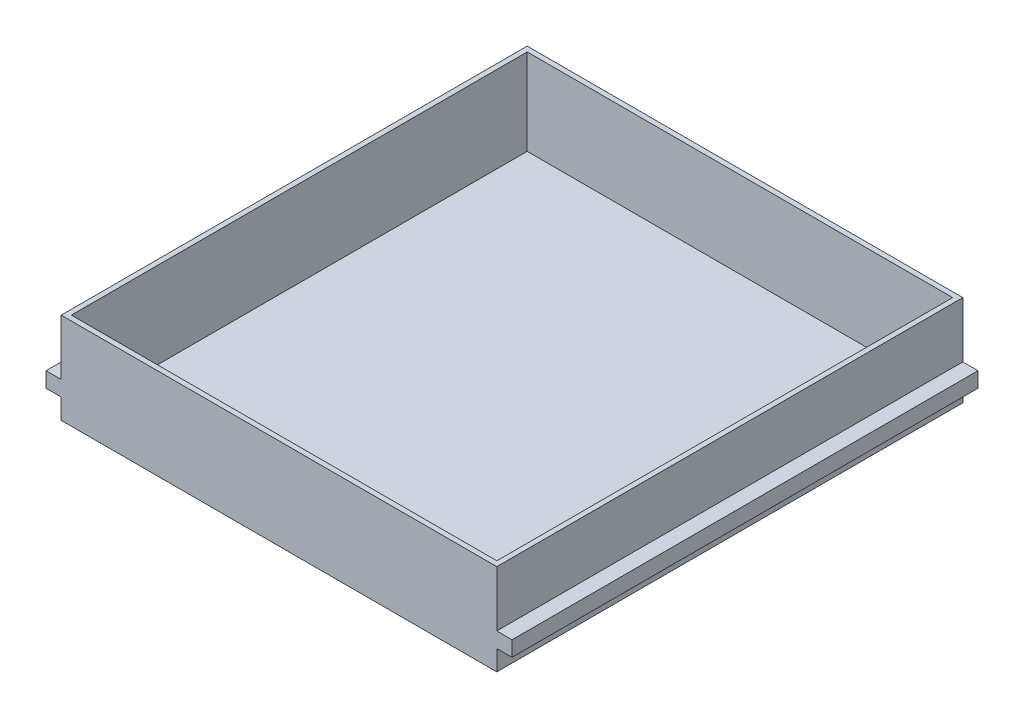
from build123d import *

# Parameters (mm, degrees)
SKETCH1_W           = 1092.2
SKETCH1_H           = 1168.4
BOSS_EXTRUDE1_DEPTH = 12.7
SKETCH2_W           = 1092.2
SKETCH2_H           = 1168.4
SKETCH2_W_2         = 1066.8
SKETCH2_H_2         = 1143
BOSS_EXTRUDE2_DEPTH = 215.9
SKETCH3_W           = 38.1
SKETCH3_H           = 38.1
BOSS_EXTRUDE3_DEPTH = 1168.4


with BuildPart() as part:
    # Sketch1 → Boss-Extrude1 (new body)
    with BuildSketch(Plane(origin=(0, 0, 0), x_dir=(1, 0, 0), z_dir=(0, 1, 0))):
        Rectangle(SKETCH1_W, SKETCH1_H)
    extrude(amount=BOSS_EXTRUDE1_DEPTH)

    # Sketch2 → Boss-Extrude2 (add)
    with BuildSketch(Plane(origin=(0, 12.7, 0), x_dir=(1, 0, 0), z_dir=(0, 1, 0))):
        Rectangle(SKETCH2_W, SKETCH2_H)
        Rectangle(SKETCH2_W_2, SKETCH2_H_2, mode=Mode.SUBTRACT)
    extrude(amount=BOSS_EXTRUDE2_DEPTH)

    # Sketch3 → Boss-Extrude3 (add)
    with BuildSketch(Plane(origin=(0, 0, -584.2), x_dir=(-1, 0, 0), z_dir=(0, 0, -1))):
        with Locations((565.15, 69.85)):
            Rectangle(SKETCH3_W, SKETCH3_H)
        with Locations((-565.15, 69.85)):
            Rectangle(SKETCH3_W, SKETCH3_H)
    extrude(amount=-BOSS_EXTRUDE3_DEPTH)


solid = part.part
